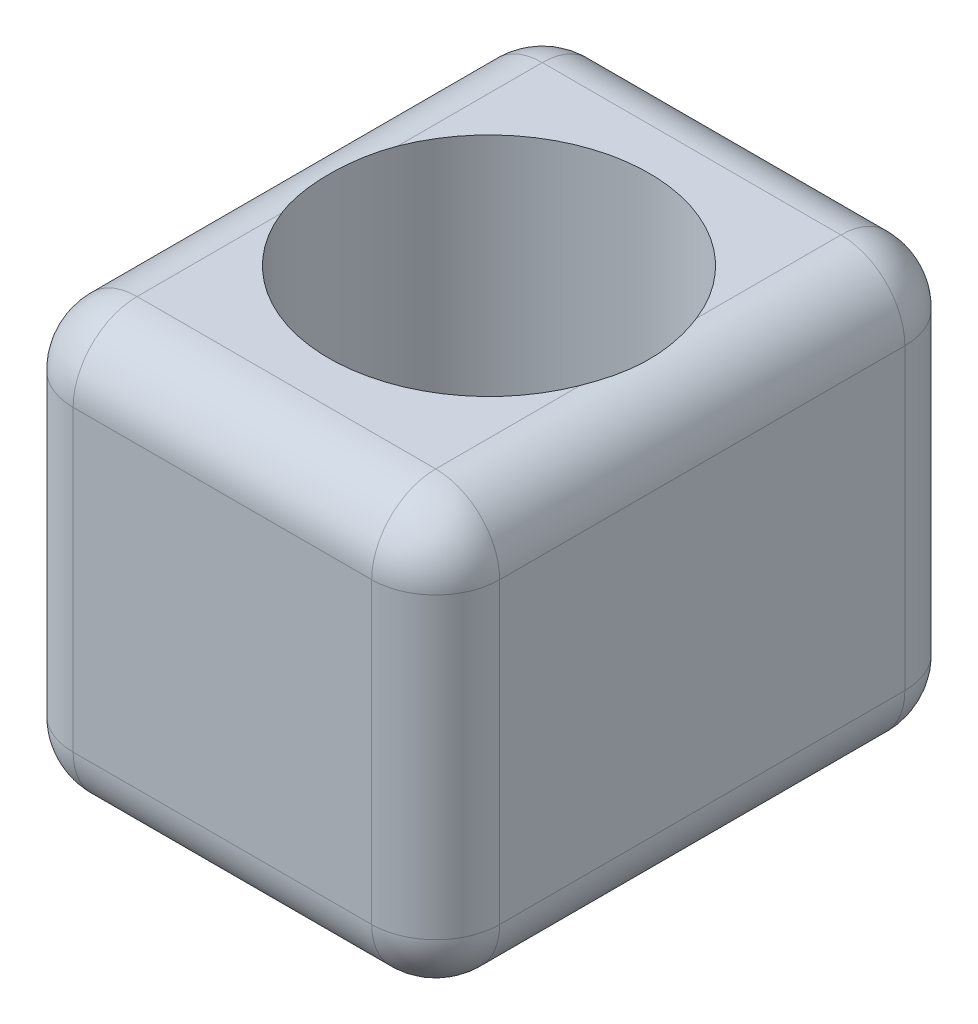
from build123d import *

# Parameters (mm, degrees)
SKETCH1_W           = 40
SKETCH1_H           = 40
BOSS_EXTRUDE1_DEPTH = 50
FILLET1_R           = 6
SKETCH2_R           = 15.025
CUT_EXTRUDE1_DEPTH  = 50


with BuildPart() as part:
    # Sketch1 → Boss-Extrude1 (new body)
    with BuildSketch(Plane.XY):
        Rectangle(SKETCH1_W, SKETCH1_H)
    extrude(amount=BOSS_EXTRUDE1_DEPTH)

    # Fillet1
    fillet1_edges = [part.edges().sort_by_distance(p)[0] for p in [
        (-20, 0, 50),
        (0, -20, 50),
        (20, 0, 50),
        (0, -20, 0),
        (-20, 0, 0),
        (0, 20, 0),
        (20, 0, 0),
        (0, 20, 50),
        (20, -20, 25),
        (-20, -20, 25),
        (-20, 20, 25),
        (20, 20, 25),
    ]]
    fillet(fillet1_edges, radius=FILLET1_R)

    # Sketch2 → Cut-Extrude1 (cut)
    with BuildSketch(Plane(origin=(0, 20, 0), x_dir=(1, 0, 0), z_dir=(0, 1, 0))):
        with Locations(Location((0, -25, 0), (0, 0, 201.285935721))):
            Circle(SKETCH2_R)
    extrude(amount=-CUT_EXTRUDE1_DEPTH, mode=Mode.SUBTRACT)


solid = part.part
